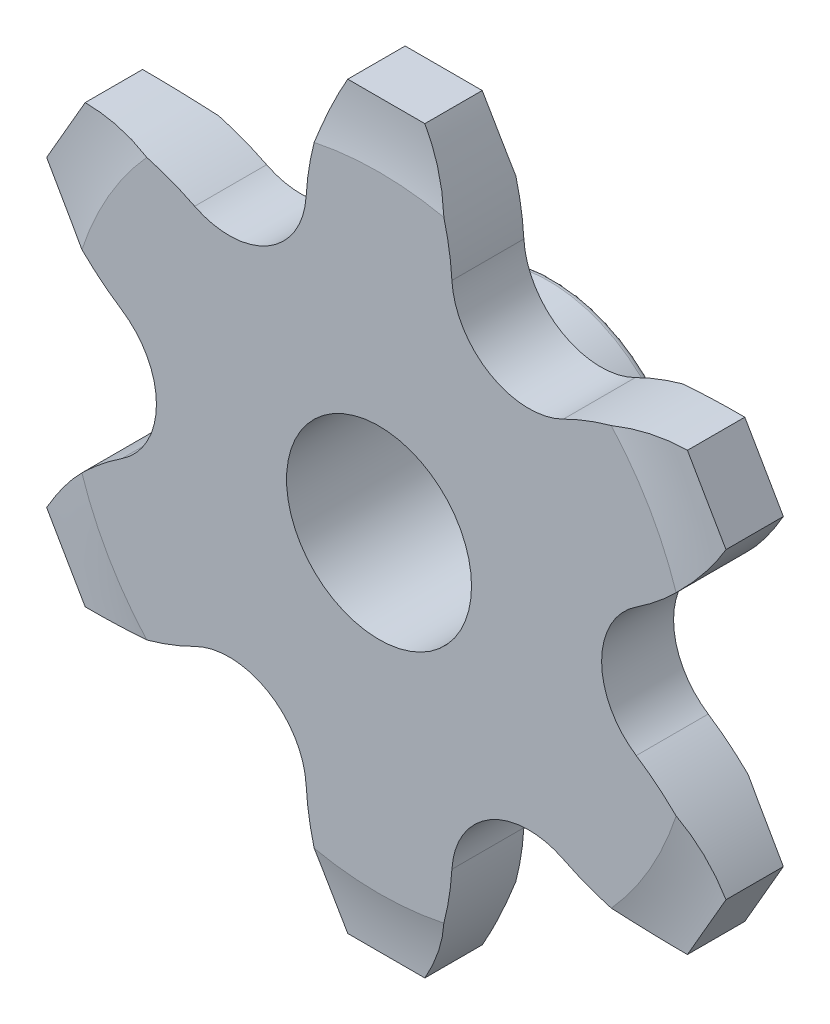
from build123d import *

# Parameters (mm, degrees)
SKETCH2_R           = 30
BOSS_EXTRUDE1_DEPTH = 11.67
BOSS_EXTRUDE2_START = -57
SKETCH4_R           = 43.3
SKETCH4_R_2         = 30
BOSS_EXTRUDE2_DEPTH = 57
FILLET1_R           = 2


with BuildPart() as part:
    # Sketch2 → Boss-Extrude1 (new, symmetric)
    with BuildSketch(Plane.XY):
        with BuildLine():
            Line((-12.5, 120), (12.5, 120))
            ThreePointArc((12.5, 120), (20.236345621, 101.995330975), (23.643859133, 82.697455395))
            ThreePointArc((23.643859133, 82.697455395), (36.1, 62.527034153), (59.796167634, 61.824910351))
            ThreePointArc((59.796167634, 61.824910351), (78.212374881, 68.522854875), (97.673048454, 70.825317547))
            Line((97.673048454, 70.825317547), (110.173048454, 49.174682453))
            ThreePointArc((110.173048454, 49.174682453), (98.448720503, 33.4724761), (83.440026767, 20.872545044))
            ThreePointArc((83.440026767, 20.872545044), (72.2, 0), (83.440026767, -20.872545044))
            ThreePointArc((83.440026767, -20.872545044), (98.448720503, -33.4724761), (110.173048454, -49.174682453))
            Line((110.173048454, -49.174682453), (97.673048454, -70.825317547))
            ThreePointArc((97.673048454, -70.825317547), (78.212374881, -68.522854875), (59.796167634, -61.824910351))
            ThreePointArc((59.796167634, -61.824910351), (36.1, -62.527034153), (23.643859133, -82.697455395))
            ThreePointArc((23.643859133, -82.697455395), (20.236345621, -101.995330975), (12.5, -120))
            Line((12.5, -120), (-12.5, -120))
            ThreePointArc((-12.5, -120), (-20.236345621, -101.995330975), (-23.643859133, -82.697455395))
            ThreePointArc((-23.643859133, -82.697455395), (-36.1, -62.527034153), (-59.796167634, -61.824910351))
            ThreePointArc((-59.796167634, -61.824910351), (-78.212374881, -68.522854875), (-97.673048454, -70.825317547))
            Line((-97.673048454, -70.825317547), (-110.173048454, -49.174682453))
            ThreePointArc((-110.173048454, -49.174682453), (-98.448720503, -33.4724761), (-83.440026767, -20.872545044))
            ThreePointArc((-83.440026767, -20.872545044), (-72.2, 0), (-83.440026767, 20.872545044))
            ThreePointArc((-83.440026767, 20.872545044), (-98.448720503, 33.4724761), (-110.173048454, 49.174682453))
            Line((-110.173048454, 49.174682453), (-97.673048454, 70.825317547))
            ThreePointArc((-97.673048454, 70.825317547), (-78.212374881, 68.522854875), (-59.796167634, 61.824910351))
            ThreePointArc((-59.796167634, 61.824910351), (-36.1, 62.527034153), (-23.643859133, 82.697455395))
            ThreePointArc((-23.643859133, 82.697455395), (-20.236345621, 101.995330975), (-12.5, 120))
        make_face()
        Circle(SKETCH2_R, mode=Mode.SUBTRACT)
    extrude(amount=BOSS_EXTRUDE1_DEPTH, both=True)

    # Sketch3 → Cut-Revolve3 (revolve, cut)
    with BuildSketch(Plane(origin=(0, 0, 0), x_dir=(0, 0, -1), z_dir=(1, 0, 0))):
        with BuildLine():
            Line((-9.298765392, 121.603522868), (-9.298765392, 129.425144156))
            Line((-9.298765392, 129.425144156), (-28.94821126, 129.425144156))
            Line((-28.94821126, 129.425144156), (-28.94821126, 101.348727697))
            Line((-28.94821126, 101.348727697), (-11.67, 101.348727697))
            ThreePointArc((-11.67, 101.348727697), (-9.89359142, 111.406961181), (-9.298765392, 121.603522868))
        make_face()
    cut_revolve3 = revolve(axis=Axis((0, 0, 0), (0, 0, -1)), mode=Mode.SUBTRACT)

    # Mirror1: Cut-Revolve3 across plane
    add(cut_revolve3.mirror(Plane.XY), mode=Mode.SUBTRACT)

    # Sketch4 → Boss-Extrude2 (add)
    with BuildSketch(Plane.XY.offset(11.67).offset(BOSS_EXTRUDE2_START)):
        Circle(SKETCH4_R)
        Circle(SKETCH4_R_2, mode=Mode.SUBTRACT)
    extrude(amount=BOSS_EXTRUDE2_DEPTH)

    # Sketch5 → Revolve1 (revolve)
    with BuildSketch(Plane(origin=(0, 0, 0), x_dir=(0, 0, -1), z_dir=(1, 0, 0)), mode=Mode.PRIVATE) as revolve1_sk:
        Polygon((27.83, 43.3), (11.67, 43.3), (11.67, 52.31), align=None)
    revolve(revolve1_sk.sketch.rotate(Axis((0, 0, 0), (0, 0, 1)), 270), axis=Axis((0, 0, 0), (0, 0, 1)))

    # Fillet1
    fillet1_edges = [part.edges().sort_by_distance(p)[0] for p in [
        (-43.3, 0, -45.33),
    ]]
    fillet(fillet1_edges, radius=FILLET1_R)


solid = part.part
